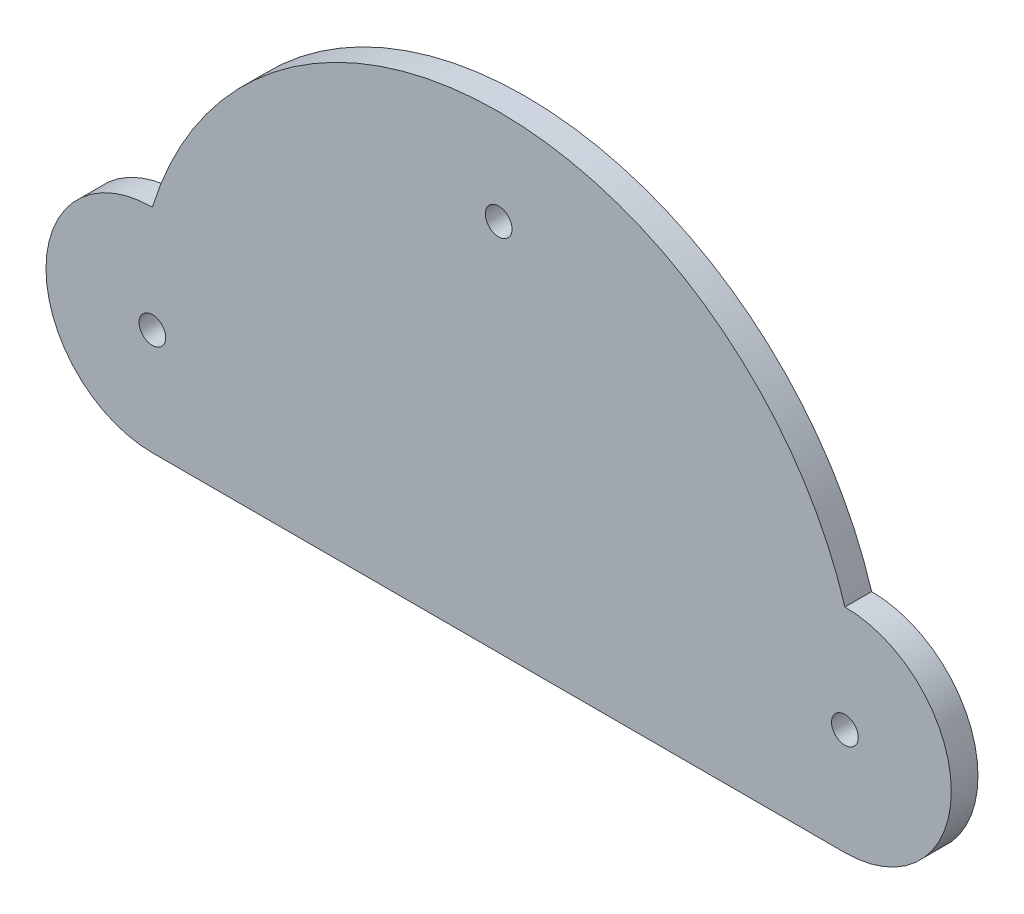
from build123d import *

# Parameters (mm, degrees)
CROQUIS1_R              = 1.5
SALIENTE_EXTRUIR1_DEPTH = 3


with BuildPart() as part:
    # Croquis1 → Saliente-Extruir1 (new body)
    with BuildSketch(Plane.XY):
        with BuildLine():
            Line((0, -11.947743298), (77.78, -11.947743298))
            ThreePointArc((77.78, -11.947743298), (89.727743298, 0), (77.78, 11.947743298))
            ThreePointArc((77.78, 11.947743298), (38.89, 40.683911684), (0, 11.947743298))
            ThreePointArc((0, 11.947743298), (-11.947743298, 0), (0, -11.947743298))
        make_face()
        Circle(CROQUIS1_R, mode=Mode.SUBTRACT)
        with Locations((77.78, 0)):
            Circle(CROQUIS1_R, mode=Mode.SUBTRACT)
        with Locations((38.89, 30)):
            Circle(CROQUIS1_R, mode=Mode.SUBTRACT)
    extrude(amount=SALIENTE_EXTRUIR1_DEPTH)


solid = part.part
